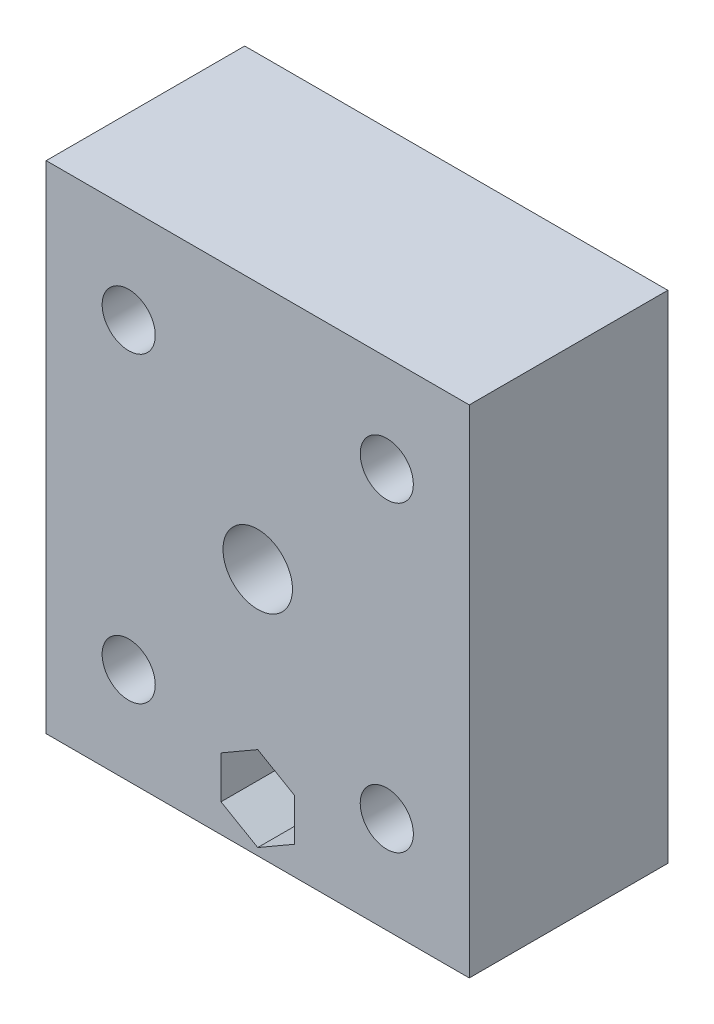
from build123d import *

# Parameters (mm, degrees)
SKETCH1_W           = 42.62295082
SKETCH1_H           = 50
SKETCH1_R           = 2.677018134
BOSS_EXTRUDE1_DEPTH = 20
SKETCH2_R           = 5.025
CUT_EXTRUDE2_DEPTH  = 3
SKETCH3_R           = 2.2
CUT_EXTRUDE3_DEPTH  = 10
CUT_EXTRUDE4_START  = -7
CUT_EXTRUDE4_DEPTH  = 32.460095998
SKETCH6_R           = 3.5
CUT_EXTRUDE5_DEPTH  = 39.460095998


with BuildPart() as part:
    # Sketch1 → Boss-Extrude1 (new body)
    with BuildSketch(Plane.XY):
        Rectangle(SKETCH1_W, SKETCH1_H)
        with Locations((-13, -15.25)):
            Circle(SKETCH1_R, mode=Mode.SUBTRACT)
        with Locations(Location((13, -15.25, 0), (0, 0, 180))):
            Circle(SKETCH1_R, mode=Mode.SUBTRACT)
        with Locations((13, 15.25)):
            Circle(SKETCH1_R, mode=Mode.SUBTRACT)
        with Locations(Location((-13, 15.25, 0), (0, 0, 180))):
            Circle(SKETCH1_R, mode=Mode.SUBTRACT)
    extrude(amount=BOSS_EXTRUDE1_DEPTH)

    # Sketch2 → Cut-Extrude2 (cut)
    with BuildSketch(Plane.XY):
        Circle(SKETCH2_R)
    extrude(amount=CUT_EXTRUDE2_DEPTH, mode=Mode.SUBTRACT)

    # Sketch3 → Cut-Extrude3 (cut)
    with BuildSketch(Plane(origin=(0, 0, 0), x_dir=(-1, 0, 0), z_dir=(0, 0, -1))):
        with Locations((0, -20)):
            Circle(SKETCH3_R)
    extrude(amount=-CUT_EXTRUDE3_DEPTH, mode=Mode.SUBTRACT)

    # Sketch5 → Cut-Extrude4 (cut, through all)
    with BuildSketch(Plane(origin=(0, 0, 0), x_dir=(-1, 0, 0), z_dir=(0, 0, -1)).offset(CUT_EXTRUDE4_START)):
        Polygon((0, -15.727608008), (-3.7, -17.863804004), (-3.7, -22.136195996), (0, -24.272391992), (3.7, -22.136195996), (3.7, -17.863804004), align=None)
    extrude(amount=-CUT_EXTRUDE4_DEPTH, mode=Mode.SUBTRACT)

    # Sketch6 → Cut-Extrude5 (cut, through all)
    with BuildSketch(Plane.XY):
        Circle(SKETCH6_R)
    extrude(amount=CUT_EXTRUDE5_DEPTH, mode=Mode.SUBTRACT)


solid = part.part
